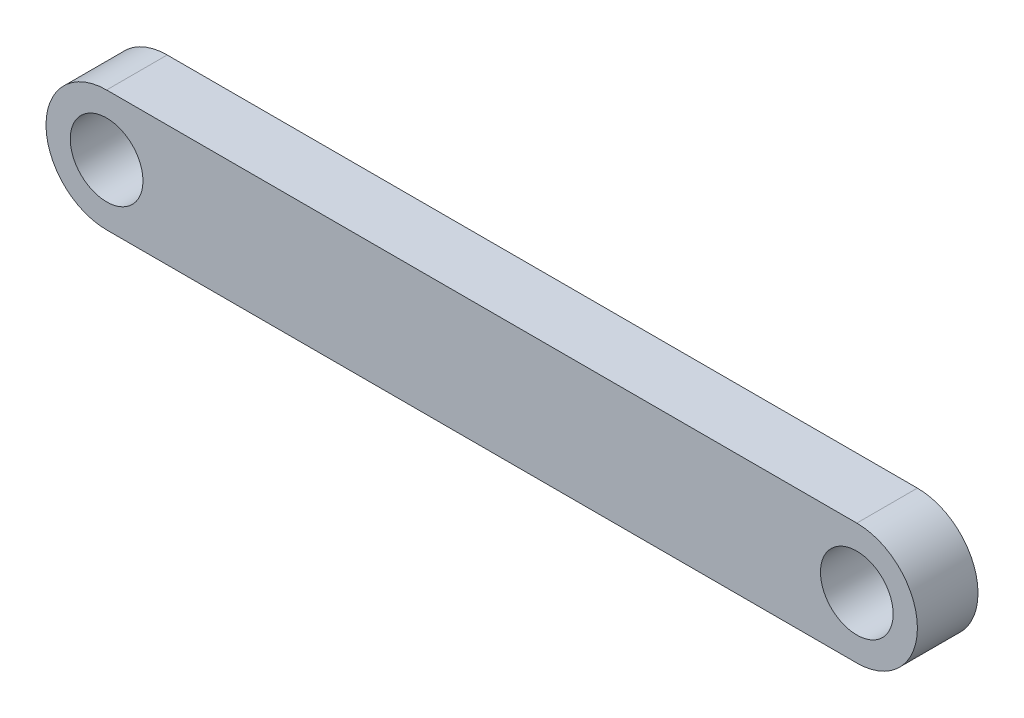
from build123d import *

# Parameters (mm, degrees)
SKETCH1_R           = 3
BOSS_EXTRUDE1_DEPTH = 5


with BuildPart() as part:
    # Sketch1 → Boss-Extrude1 (new body)
    with BuildSketch(Plane.XY):
        with BuildLine():
            Line((30.95, -5), (-30.95, -5))
            ThreePointArc((-30.95, -5), (-35.95, 0), (-30.95, 5))
            Line((-30.95, 5), (30.95, 5))
            ThreePointArc((30.95, 5), (35.95, 0), (30.95, -5))
        make_face()
        with Locations((-30.95, 0)):
            Circle(SKETCH1_R, mode=Mode.SUBTRACT)
        with Locations((30.95, 0)):
            Circle(SKETCH1_R, mode=Mode.SUBTRACT)
    extrude(amount=BOSS_EXTRUDE1_DEPTH)


solid = part.part
